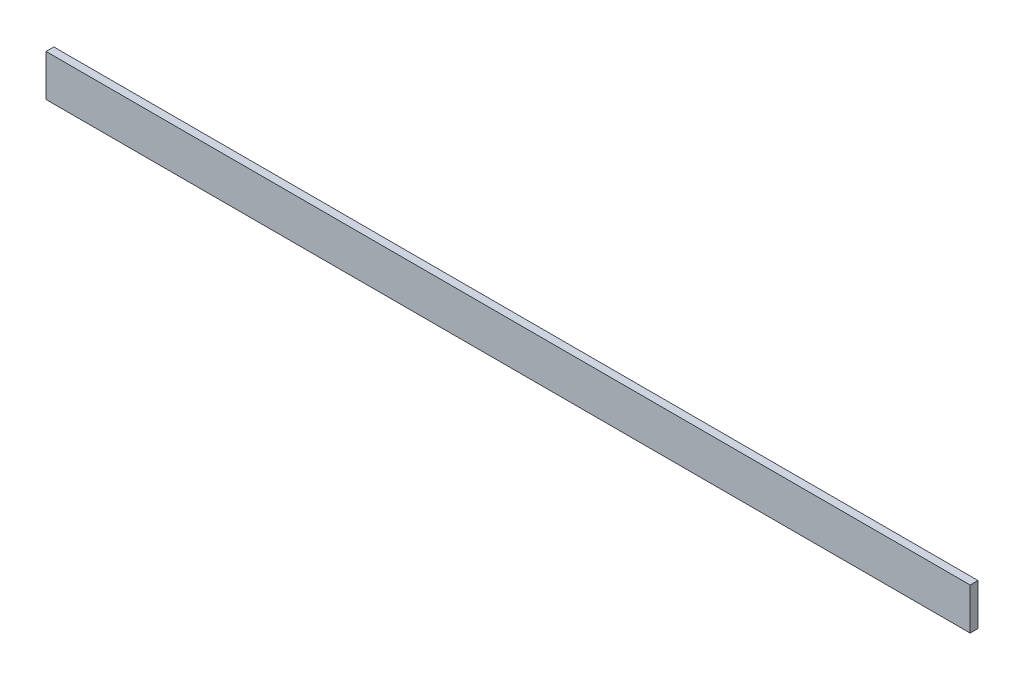
from build123d import *

# Parameters (mm, degrees)
CROQUIS1_W              = 1127.6
CROQUIS1_H              = 50.8
SALIENTE_EXTRUIR1_DEPTH = 9.525


with BuildPart() as part:
    # Croquis1 → Saliente-Extruir1 (new body)
    with BuildSketch(Plane.XY):
        with Locations((563.8, 25.4)):
            Rectangle(CROQUIS1_W, CROQUIS1_H)
    extrude(amount=SALIENTE_EXTRUIR1_DEPTH)


solid = part.part
